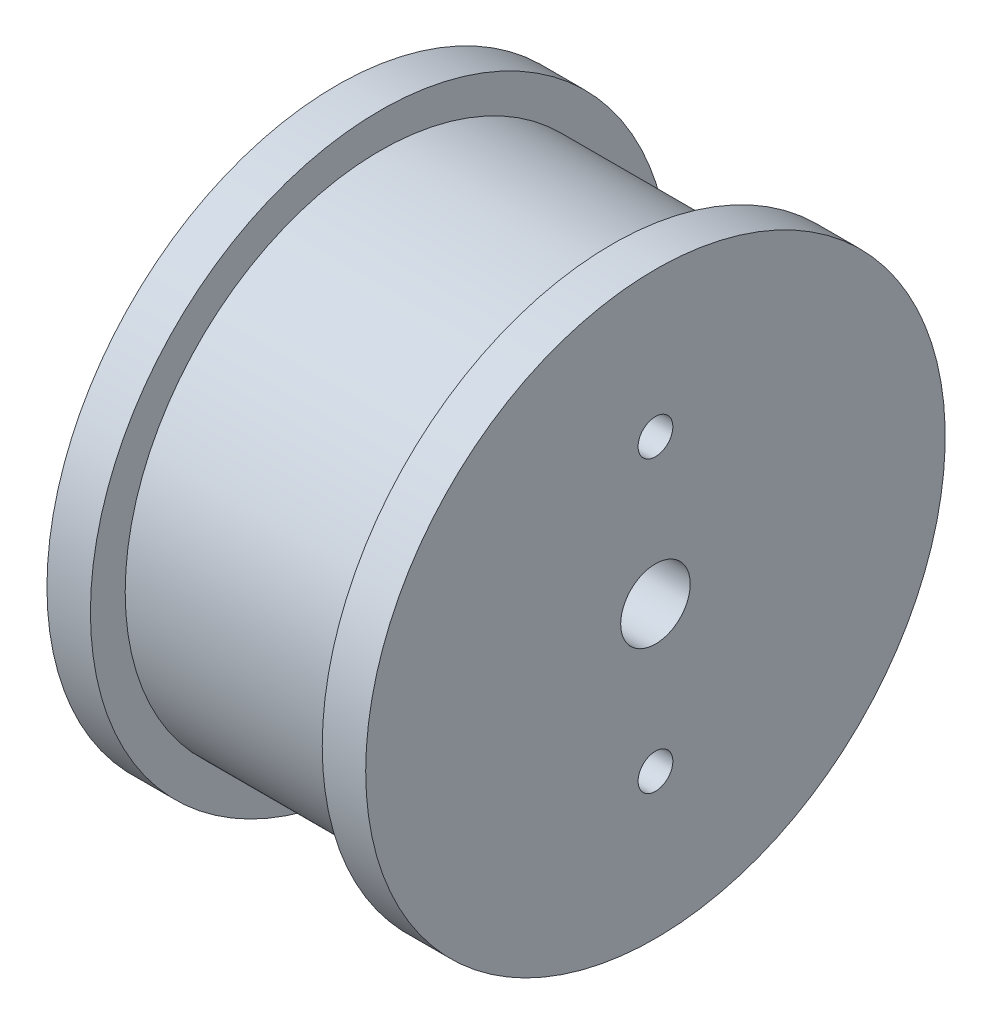
from build123d import *

# Parameters (mm, degrees)
SKETCH3_R          = 3
CUT_EXTRUDE1_DEPTH = 90.582364336


with BuildPart() as part:
    # Sketch1 → Revolve1 (revolve)
    with BuildSketch(Plane.XY, mode=Mode.PRIVATE) as revolve1_sk:
        Polygon((20, 50), (27.5, 50), (27.5, 6), (-27.5, 6), (-27.5, 50), (-20, 50), (-20, 44), (20, 44), align=None)
    revolve(revolve1_sk.sketch.rotate(Axis((-137.236084453, 0, 0), (1, 0, 0)), 90), axis=Axis((-137.236084453, 0, 0), (1, 0, 0)))

    # Sketch3 → Cut-Extrude1 (cut, through all)
    with BuildSketch(Plane(origin=(27.5, 0, 0), x_dir=(0, 0, -1), z_dir=(1, 0, 0))):
        with Locations((0, 25)):
            Circle(SKETCH3_R)
        with Locations((0, -25)):
            Circle(SKETCH3_R)
    extrude(amount=-CUT_EXTRUDE1_DEPTH, mode=Mode.SUBTRACT)


solid = part.part
